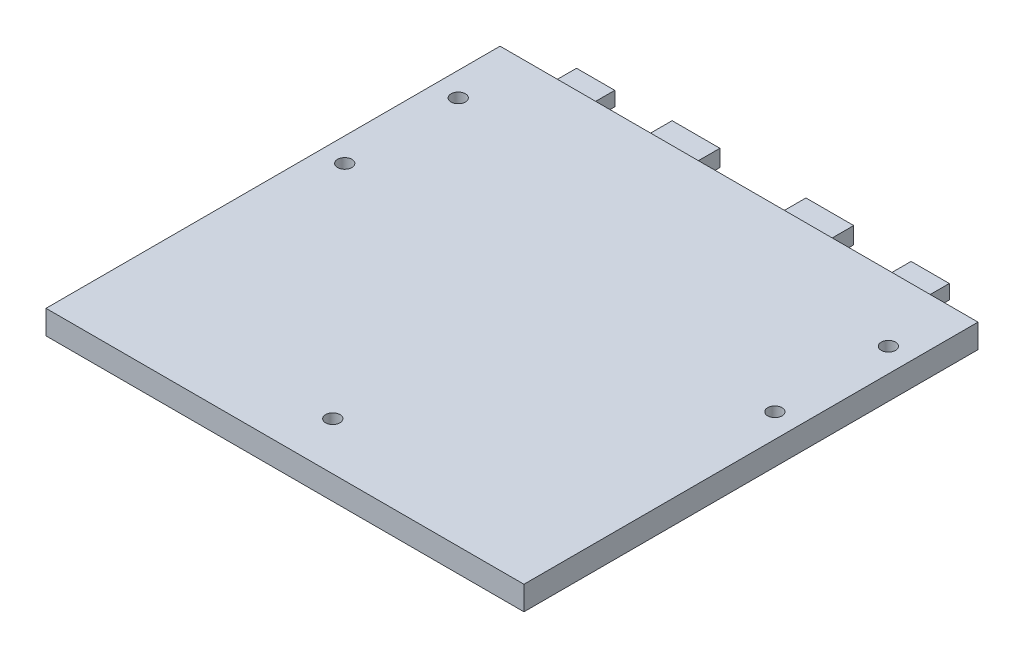
from build123d import *

# Parameters (mm, degrees)
SKETCH1_W           = 200
SKETCH1_H           = 190
BOSS_EXTRUDE1_DEPTH = 10
SKETCH2_W           = 16
SKETCH2_H           = 6
SKETCH2_W_2         = 20
SKETCH2_H_2         = 7
BOSS_EXTRUDE2_DEPTH = 10
SKETCH3_R           = 3
CUT_EXTRUDE1_DEPTH  = 10
SKETCH4_R           = 3
CUT_EXTRUDE2_DEPTH  = 10


with BuildPart() as part:
    # Sketch1 → Boss-Extrude1 (new body)
    with BuildSketch(Plane(origin=(0, 0, 0), x_dir=(1, 0, 0), z_dir=(0, 1, 0))):
        with Locations((100, 95)):
            Rectangle(SKETCH1_W, SKETCH1_H)
    extrude(amount=BOSS_EXTRUDE1_DEPTH)

    # Sketch2 → Boss-Extrude2 (add)
    with BuildSketch(Plane(origin=(0, 0, -190), x_dir=(-1, 0, 0), z_dir=(0, 0, -1))):
        with Locations((-30, 5)):
            Rectangle(SKETCH2_W, SKETCH2_H)
        with Locations((-170, 5)):
            Rectangle(SKETCH2_W, SKETCH2_H)
        with Locations((-128, 5.5)):
            Rectangle(SKETCH2_W_2, SKETCH2_H_2)
        with Locations((-72, 5.5)):
            Rectangle(SKETCH2_W_2, SKETCH2_H_2)
    extrude(amount=BOSS_EXTRUDE2_DEPTH)

    # Sketch3 → Cut-Extrude1 (cut)
    with BuildSketch(Plane(origin=(0, 10, 0), x_dir=(1, 0, 0), z_dir=(0, 1, 0))):
        with Locations(Location((190, 162.5, 0), (0, 0, 270))):
            Circle(SKETCH3_R)
        with Locations(Location((190, 115, 0), (0, 0, 270))):
            Circle(SKETCH3_R)
        with Locations(Location((10, 162.5, 0), (0, 0, 90))):
            Circle(SKETCH3_R)
        with Locations(Location((10, 115, 0), (0, 0, 90))):
            Circle(SKETCH3_R)
    extrude(amount=-CUT_EXTRUDE1_DEPTH, mode=Mode.SUBTRACT)

    # Sketch4 → Cut-Extrude2 (cut)
    with BuildSketch(Plane(origin=(0, 10, 0), x_dir=(1, 0, 0), z_dir=(0, 1, 0))):
        with Locations(Location((100, 20, 0), (0, 0, 270))):
            Circle(SKETCH4_R)
    extrude(amount=-CUT_EXTRUDE2_DEPTH, mode=Mode.SUBTRACT)


solid = part.part
